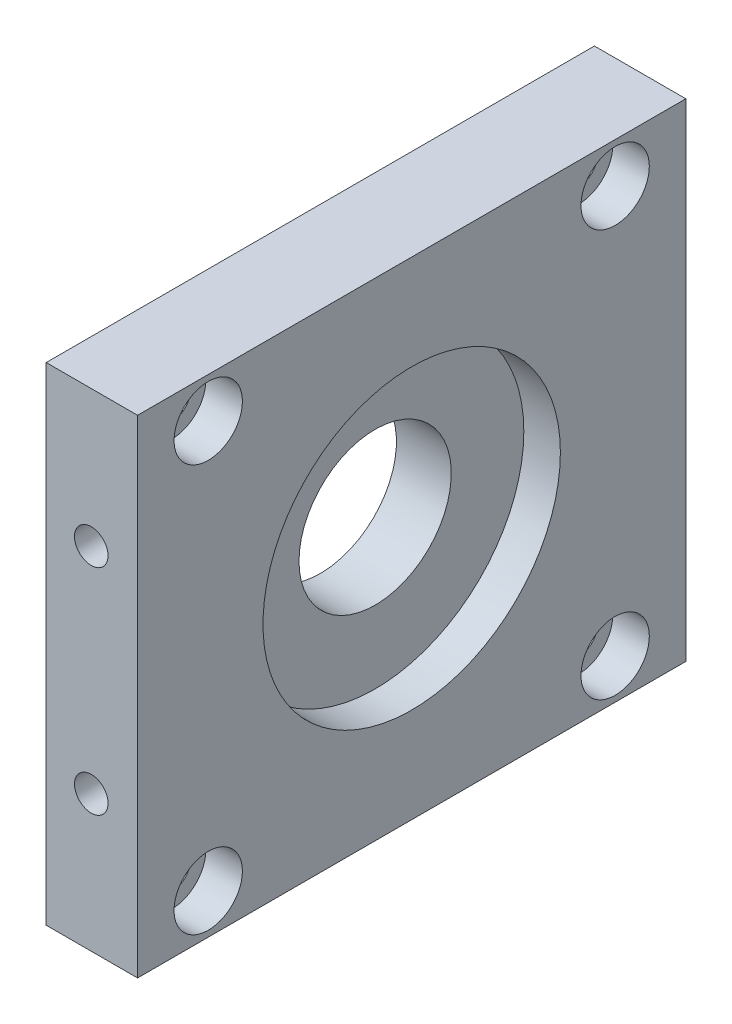
from build123d import *

# Parameters (mm, degrees)
SKETCH1_W                       = 101.6
SKETCH1_H                       = 114.3
BOSS_EXTRUDE1_DEPTH             = 19.05
SKETCH2_R                       = 30.999938
CUT_EXTRUDE1_DEPTH              = 7.62
SKETCH4_R                       = 15.875
CUT_EXTRUDE2_DEPTH              = 155.110195964
SKETCH5_R                       = 4.0005
CUT_EXTRUDE4_DEPTH              = 155.110195964
SKETCH10_R                      = 7.12499972
CUT_EXTRUDE5_DEPTH              = 7.62
TAP_DRILL_FOR_M8X1_0_TAP2_D     = 7
TAP_DRILL_FOR_M8X1_0_TAP2_DEPTH = 25.4
TAP_DRILL_FOR_M8X1_0_TAP2_TIP   = 2.103012167
TAP_DRILL_FOR_M8X1_0_TAP3_D     = 7
TAP_DRILL_FOR_M8X1_0_TAP3_DEPTH = 25.4
TAP_DRILL_FOR_M8X1_0_TAP3_TIP   = 2.103012167


with BuildPart() as part:
    # Sketch1 → Boss-Extrude1 (new body)
    with BuildSketch(Plane.YZ):
        with Locations((50.8, 57.15)):
            Rectangle(SKETCH1_W, SKETCH1_H)
    extrude(amount=BOSS_EXTRUDE1_DEPTH)

    # Sketch2 → Cut-Extrude1 (cut)
    with BuildSketch(Plane.YZ.offset(19.05)):
        with Locations(Location((50.8, 57.15, 0), (0, 0, 270))):
            Circle(SKETCH2_R)
    extrude(amount=-CUT_EXTRUDE1_DEPTH, mode=Mode.SUBTRACT)

    # Sketch4 → Cut-Extrude2 (cut, through all)
    with BuildSketch(Plane(origin=(0, 0, 0), x_dir=(0, -1, 0), z_dir=(-1, 0, 0))):
        with Locations(Location((-50.8, 57.15, 0), (0, 0, 90))):
            Circle(SKETCH4_R)
    extrude(amount=-CUT_EXTRUDE2_DEPTH, mode=Mode.SUBTRACT)

    # Sketch5 → Cut-Extrude4 (cut, through all)
    with BuildSketch(Plane.YZ.offset(19.05)):
        with Locations(Location((8.382, 99.568, 0), (0, 0, 270))):
            Circle(SKETCH5_R)
        with Locations(Location((93.218, 99.568, 0), (0, 0, 270))):
            Circle(SKETCH5_R)
        with Locations(Location((93.218, 14.732, 0), (0, 0, 270))):
            Circle(SKETCH5_R)
        with Locations(Location((8.382, 14.732, 0), (0, 0, 270))):
            Circle(SKETCH5_R)
    extrude(amount=-CUT_EXTRUDE4_DEPTH, mode=Mode.SUBTRACT)

    # Sketch10 → Cut-Extrude5 (cut)
    with BuildSketch(Plane.YZ.offset(19.05)):
        with Locations(Location((8.382, 99.568, 0), (0, 0, 270))):
            Circle(SKETCH10_R)
        with Locations(Location((93.218, 99.568, 0), (0, 0, 270))):
            Circle(SKETCH10_R)
        with Locations(Location((93.218, 14.732, 0), (0, 0, 270))):
            Circle(SKETCH10_R)
        with Locations(Location((8.382, 14.732, 0), (0, 0, 270))):
            Circle(SKETCH10_R)
    extrude(amount=-CUT_EXTRUDE5_DEPTH, mode=Mode.SUBTRACT)

    # Tap Drill for M8x1.0 Tap2
    with Locations(Plane.XY.offset(114.3)):
        with Locations((9.398, 73.152), (9.398, 28.448)):
            Hole(TAP_DRILL_FOR_M8X1_0_TAP2_D / 2, depth=TAP_DRILL_FOR_M8X1_0_TAP2_DEPTH)
            with Locations((0, 0, -(TAP_DRILL_FOR_M8X1_0_TAP2_DEPTH + TAP_DRILL_FOR_M8X1_0_TAP2_TIP / 2))):  # 118° drill point
                Cone(0, TAP_DRILL_FOR_M8X1_0_TAP2_D / 2, TAP_DRILL_FOR_M8X1_0_TAP2_TIP, mode=Mode.SUBTRACT)

    # Tap Drill for M8x1.0 Tap3
    with Locations(Plane(origin=(0, 0, 0), x_dir=(1, 0, 0), z_dir=(0, 0, -1))):
        with Locations((9.398, -73.152), (9.398, -28.448)):
            Hole(TAP_DRILL_FOR_M8X1_0_TAP3_D / 2, depth=TAP_DRILL_FOR_M8X1_0_TAP3_DEPTH)
            with Locations((0, 0, -(TAP_DRILL_FOR_M8X1_0_TAP3_DEPTH + TAP_DRILL_FOR_M8X1_0_TAP3_TIP / 2))):  # 118° drill point
                Cone(0, TAP_DRILL_FOR_M8X1_0_TAP3_D / 2, TAP_DRILL_FOR_M8X1_0_TAP3_TIP, mode=Mode.SUBTRACT)


solid = part.part
